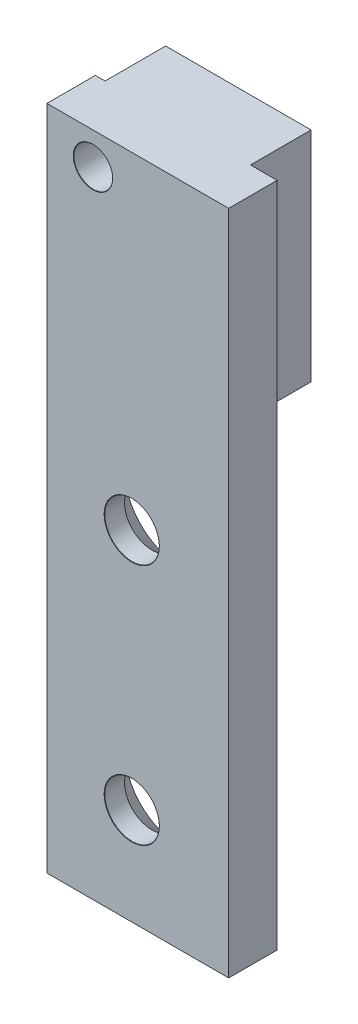
from build123d import *

# Parameters (mm, degrees)
SKETCH1_W                                    = 15
SKETCH1_H                                    = 55
BOSS_EXTRUDE1_DEPTH                          = 4
CSK_FOR_M4_HEX_SOCKET_COUNTERSUNK_HE_2_COUNT = 2
CSK_FOR_M4_HEX_SOCKET_COUNTERSUNK_HE_2_PITCH = 20
SKETCH15_W                                   = 12
SKETCH15_H                                   = 18
BOSS_EXTRUDE2_DEPTH                          = 5


with BuildPart() as part:
    # Sketch1 → Boss-Extrude1 (new body)
    with BuildSketch(Plane.XY):
        Rectangle(SKETCH1_W, SKETCH1_H)
    extrude(amount=BOSS_EXTRUDE1_DEPTH)

    # Sketch5 → CSK for M4 Hex Socket Countersunk Head Screw1 (revolve, cut)
    with BuildSketch(Plane(origin=(-0.5, 0.5, 0), x_dir=(0, 1, 0), z_dir=(1, 0, 0))):
        Polygon((0, 0), (0, 4), (2.275, 4), (2.25, 3.975), (2.25, 2.34), (4.59, 0), align=None)
    csk_for_m4_hex_socket_countersunk_head_s = revolve(axis=Axis((-0.5, 0.5, -6.35), (0, 0, 1)), mode=Mode.SUBTRACT)

    # CSK for M4 Hex Socket Countersunk He 2: CSK for M4 Hex Socket Countersunk Head Screw1 ×2
    with Locations(*[(0, -i * CSK_FOR_M4_HEX_SOCKET_COUNTERSUNK_HE_2_PITCH, 0) for i in range(1, CSK_FOR_M4_HEX_SOCKET_COUNTERSUNK_HE_2_COUNT)]):
        add(csk_for_m4_hex_socket_countersunk_head_s, mode=Mode.SUBTRACT)

    # Sketch15 → Boss-Extrude2 (add)
    with BuildSketch(Plane(origin=(0, 0, 0), x_dir=(-1, 0, 0), z_dir=(0, 0, -1))):
        with Locations((0.7, 18.5)):
            Rectangle(SKETCH15_W, SKETCH15_H)
    extrude(amount=BOSS_EXTRUDE2_DEPTH)

    # Sketch19 → M3 Clearance Hole1 (revolve, cut)
    with BuildSketch(Plane(origin=(-3.7, 24.85, -5), x_dir=(0, 1, 0), z_dir=(1, 0, 0))):
        Polygon((0, 0), (0, 9), (1.625, 9), (1.6, 8.975), (1.6, 0), align=None)
    revolve(axis=Axis((-3.7, 24.85, -11.35), (0, 0, 1)), mode=Mode.SUBTRACT)


solid = part.part
